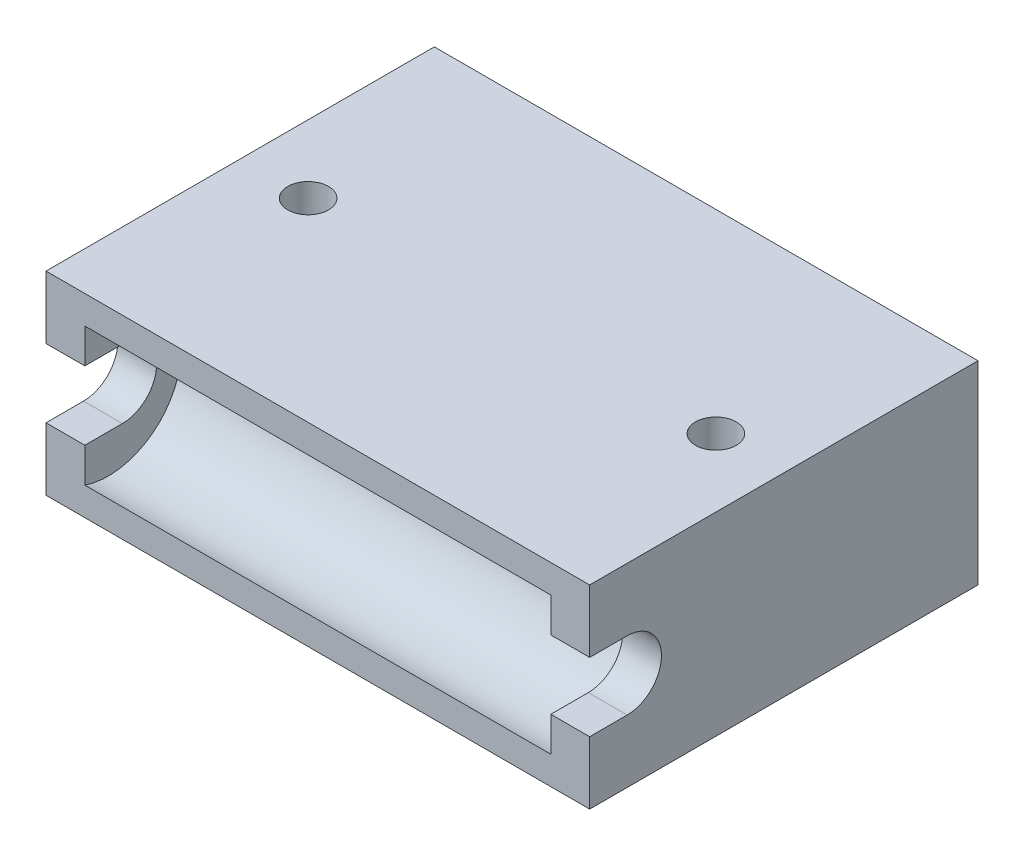
from build123d import *

# Parameters (mm, degrees)
SKETCH_1_W               = 56
SKETCH_1_H               = 40
EXTRUDE_1_DEPTH          = 20
SKETCH_2_R               = 7.5
CUT_EXTRUDE_1_DEPTH      = 48
CUT_EXTRUDE_2_DEPTH      = 70.503098378
CUT_EXTRUDE_2_DEPTH_BACK = 48
SKETCH_5_R               = 4.15
CUT_EXTRUDE_3_DEPTH      = 10
SKETCH_6_R               = 2.1
CUT_EXTRUDE_4_DEPTH      = 57.255246128
CUT_EXTRUDE_5_DEPTH      = 10


with BuildPart() as part:
    # Эскиз1 → Бобышка-Вытянуть1 (new body)
    with BuildSketch(Plane(origin=(0, 0, 0), x_dir=(1, 0, 0), z_dir=(0, 1, 0))):
        with Locations((-4.217573352, -21.553347449)):
            Rectangle(SKETCH_1_W, SKETCH_1_H)
    extrude(amount=EXTRUDE_1_DEPTH)

    # Эскиз2 → Вырез-Вытянуть1 (cut)
    with BuildSketch(Plane.ZY.offset(28.217573352)):
        with Locations((39.13573239, 10)):
            Circle(SKETCH_2_R)
    extrude(amount=-CUT_EXTRUDE_1_DEPTH, mode=Mode.SUBTRACT)

    # Эскиз4 → Вырез-Вытянуть2 (cut, two sides: drawn at the far end of the back side and taken through both)
    with BuildSketch(Plane.ZY.offset(-19.782426648).offset(-CUT_EXTRUDE_2_DEPTH_BACK)):
        with BuildLine():
            Line((37.693734465, 13.535), (41.553347449, 13.535))
            Line((41.553347449, 13.535), (41.553347449, 6.465))
            Line((41.553347449, 6.465), (37.693734465, 6.465))
            ThreePointArc((37.693734465, 6.465), (34.158734465, 10), (37.693734465, 13.535))
        make_face()
    extrude(amount=CUT_EXTRUDE_2_DEPTH + CUT_EXTRUDE_2_DEPTH_BACK, mode=Mode.SUBTRACT)

    # Эскиз5 → Вырез-Вытянуть3 (cut)
    with BuildSketch(Plane(origin=(0, 0, 1.553347449), x_dir=(-1, 0, 0), z_dir=(0, 0, -1))):
        with Locations((-16.782426648, 10)):
            Circle(SKETCH_5_R)
        with Locations((25.217573352, 10)):
            Circle(SKETCH_5_R)
    extrude(amount=-CUT_EXTRUDE_3_DEPTH, mode=Mode.SUBTRACT)

    # Эскиз6 → Вырез-Вытянуть4 (cut, through all)
    with BuildSketch(Plane(origin=(0, 20, 0), x_dir=(1, 0, 0), z_dir=(0, 1, 0))):
        with Locations(Location((-25.217573352, -21.553347449, 0), (0, 0, 270))):
            Circle(SKETCH_6_R)
        with Locations(Location((16.782426648, -21.553347449, 0), (0, 0, 270))):
            Circle(SKETCH_6_R)
    extrude(amount=-CUT_EXTRUDE_4_DEPTH, mode=Mode.SUBTRACT)

    # Эскиз7 → Вырез-Вытянуть5 (cut)
    with BuildSketch(Plane.XZ):
        Polygon((-21.176121468, 21.553347449), (-23.19684741, 25.053347449), (-27.238299295, 25.053347449), (-29.259025237, 21.553347449), (-27.238299295, 18.053347449), (-23.19684741, 18.053347449), align=None)
        Polygon((20.823878532, 21.553347449), (18.80315259, 25.053347449), (14.761700705, 25.053347449), (12.740974763, 21.553347449), (14.761700705, 18.053347449), (18.80315259, 18.053347449), align=None)
    extrude(amount=-CUT_EXTRUDE_5_DEPTH, mode=Mode.SUBTRACT)


solid = part.part
